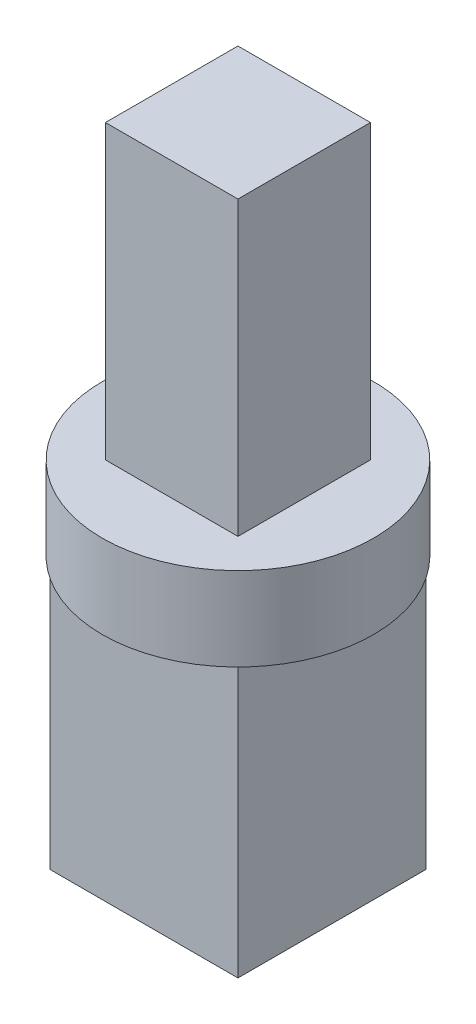
from build123d import *

# Parameters (mm, degrees)
SKETCH1_R           = 6.5
BOSS_EXTRUDE1_DEPTH = 4
SKETCH2_W           = 6.35
SKETCH2_H           = 6.35
BOSS_EXTRUDE2_DEPTH = 14
SKETCH3_W           = 9
SKETCH3_H           = 9
BOSS_EXTRUDE3_DEPTH = 13


with BuildPart() as part:
    # Sketch1 → Boss-Extrude1 (new body)
    with BuildSketch(Plane(origin=(0, 0, 0), x_dir=(1, 0, 0), z_dir=(0, 1, 0))):
        with Locations(Location((0, 0, 0), (0, 0, 270))):
            Circle(SKETCH1_R)
    extrude(amount=BOSS_EXTRUDE1_DEPTH)

    # Sketch2 → Boss-Extrude2 (add)
    with BuildSketch(Plane(origin=(0, 4, 0), x_dir=(1, 0, 0), z_dir=(0, 1, 0))):
        Rectangle(SKETCH2_W, SKETCH2_H)
    extrude(amount=BOSS_EXTRUDE2_DEPTH)

    # Sketch3 → Boss-Extrude3 (add)
    with BuildSketch(Plane.XZ):
        Rectangle(SKETCH3_W, SKETCH3_H)
    extrude(amount=BOSS_EXTRUDE3_DEPTH)


solid = part.part
